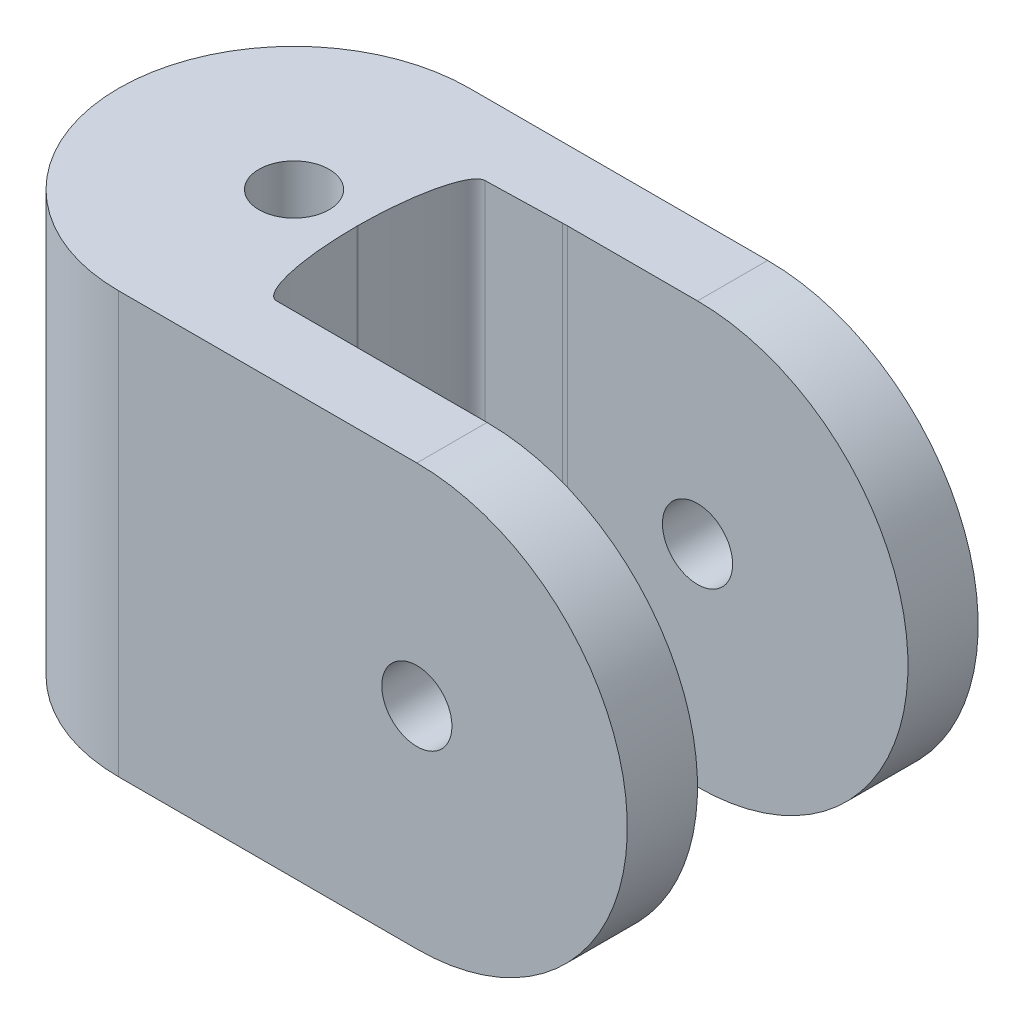
from build123d import *

# Parameters (mm, degrees)
SKETCH1_R               = 125
SKETCH1_R_2             = 25
BOSS_EXTRUDE1_DEPTH     = 300
SKETCH2_R               = 25
BOSS_EXTRUDE2_DEPTH     = 125
CUT_EXTRUDE2_DEPTH      = 75
BOSS_EXTRUDE3_DEPTH     = 300
SKETCH6_R               = 25
CUT_EXTRUDE3_DEPTH      = 487.858552354
CUT_EXTRUDE4_DEPTH      = 487.858552354
CUT_EXTRUDE4_DEPTH_BACK = 487.858552354


with BuildPart() as part:
    # Sketch1 → Boss-Extrude1 (new body)
    with BuildSketch(Plane(origin=(0, 0, 0), x_dir=(1, 0, 0), z_dir=(0, 1, 0))):
        with Locations(Location((0, 0, 0), (0, 0, 270))):
            Circle(SKETCH1_R)
        with Locations(Location((0, 0, 0), (0, 0, 270))):
            Circle(SKETCH1_R_2, mode=Mode.SUBTRACT)
    extrude(amount=BOSS_EXTRUDE1_DEPTH)

    # Sketch2 → Boss-Extrude2 (add, symmetric)
    with BuildSketch(Plane.XY):
        with BuildLine():
            Line((0, 300), (0, 0))
            Line((0, 0), (212.5, 0))
            ThreePointArc((212.5, 0), (362.5, 150), (212.5, 300))
            Line((212.5, 300), (0, 300))
        make_face()
        with Locations((212.5, 150)):
            Circle(SKETCH2_R, mode=Mode.SUBTRACT)
    extrude(amount=BOSS_EXTRUDE2_DEPTH, both=True)

    # Sketch4 → Cut-Extrude2 (cut, symmetric)
    with BuildSketch(Plane.XY):
        with BuildLine():
            Line((3.772306617, 300), (3.772306617, 0))
            Line((3.772306617, 0), (150, 0))
            ThreePointArc((150, 0), (375, 150), (150, 300))
            Line((150, 300), (3.772306617, 300))
        make_face()
    extrude(amount=CUT_EXTRUDE2_DEPTH, both=True, mode=Mode.SUBTRACT)

    # Sketch5 → Boss-Extrude3 (add, through all)
    with BuildSketch(Plane(origin=(0, 0, 0), x_dir=(1, 0, 0), z_dir=(0, 1, 0))):
        with BuildLine():
            Line((120, 75), (3.772306617, 75))
            Line((3.772306617, 75), (3.772306617, 24.713755336))
            ThreePointArc((3.772306617, 24.713755336), (18.964541458, 16.28944957), (25, 0))
            ThreePointArc((25, 0), (18.964541458, -16.28944957), (3.772306617, -24.713755336))
            Line((3.772306617, -24.713755336), (3.772306617, -75))
            Line((3.772306617, -75), (120, -75))
            ThreePointArc((120, -75), (45, 0), (120, 75))
        make_face()
    extrude(amount=BOSS_EXTRUDE3_DEPTH)

    # Sketch6 → Cut-Extrude3 (cut, through all)
    with BuildSketch(Plane(origin=(0, 300, 0), x_dir=(1, 0, 0), z_dir=(0, 1, 0))):
        with Locations(Location((0, 0, 0), (0, 0, 270))):
            Circle(SKETCH6_R)
    extrude(amount=-CUT_EXTRUDE3_DEPTH, mode=Mode.SUBTRACT)

    # Sketch10 → Cut-Extrude4 (cut, two sides: drawn at the far end of the back side and taken through both)
    with BuildSketch(Plane(origin=(0, 0, 0), x_dir=(1, 0, 0), z_dir=(0, 1, 0)).offset(-CUT_EXTRUDE4_DEPTH_BACK)):
        with BuildLine():
            Line((62.5, 73.562310608), (120, 75))
            Line((120, 75), (120, -75))
            Line((120, -75), (62.5, -75))
            add(Edge.make_bspline(
                [(62.5, 73.562310608), (45, 73.562310608), (45, -0.718844696), (45, -75), (62.5, -75)],
                knots=[0, 0, 0, 1.570796327, 1.570796327, 3.141592654, 3.141592654, 3.141592654], degree=2, weights=[1, 0.707106781, 1, 0.707106781, 1]))
        make_face()
    extrude(amount=CUT_EXTRUDE4_DEPTH + CUT_EXTRUDE4_DEPTH_BACK, mode=Mode.SUBTRACT)


solid = part.part
